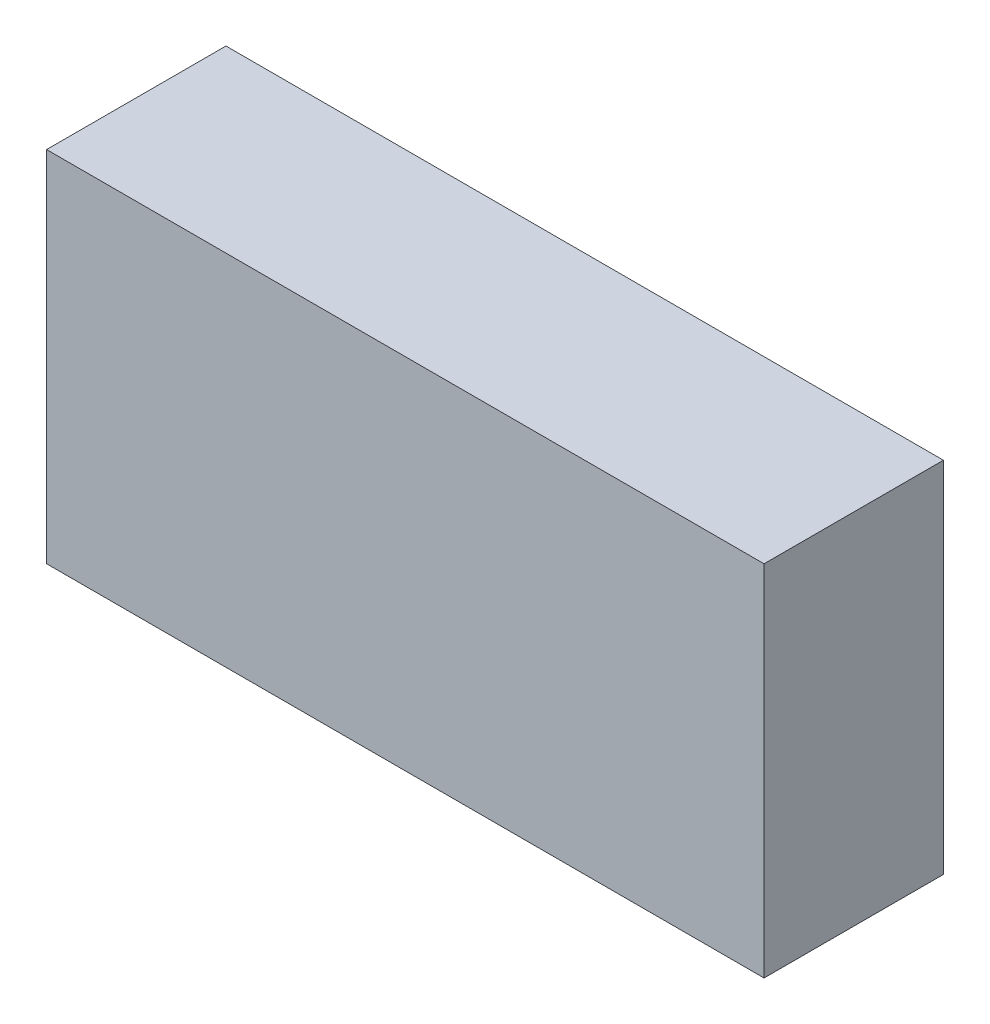
from build123d import *

# Parameters (mm, degrees)
SKETCH1_W           = 40
SKETCH1_H           = 20
BOSS_EXTRUDE1_DEPTH = 10
SKETCH2_W           = 6
SKETCH2_H           = 6
BOSS_EXTRUDE2_DEPTH = 5
SKETCH3_W           = 6
SKETCH3_H           = 6
BOSS_EXTRUDE3_DEPTH = 6


with BuildPart() as part:
    # Sketch1 → Boss-Extrude1 (new body)
    with BuildSketch(Plane.XY):
        Rectangle(SKETCH1_W, SKETCH1_H)
    extrude(amount=BOSS_EXTRUDE1_DEPTH)

    # Sketch2 → Boss-Extrude2 (add)
    with BuildSketch(Plane.XY):
        with Locations((-15, -2)):
            Rectangle(SKETCH2_W, SKETCH2_H)
    extrude(amount=BOSS_EXTRUDE2_DEPTH)

    # Sketch3 → Boss-Extrude3 (add)
    with BuildSketch(Plane.XY):
        with Locations((-6, -2)):
            Rectangle(SKETCH3_W, SKETCH3_H)
    extrude(amount=BOSS_EXTRUDE3_DEPTH)


solid = part.part
